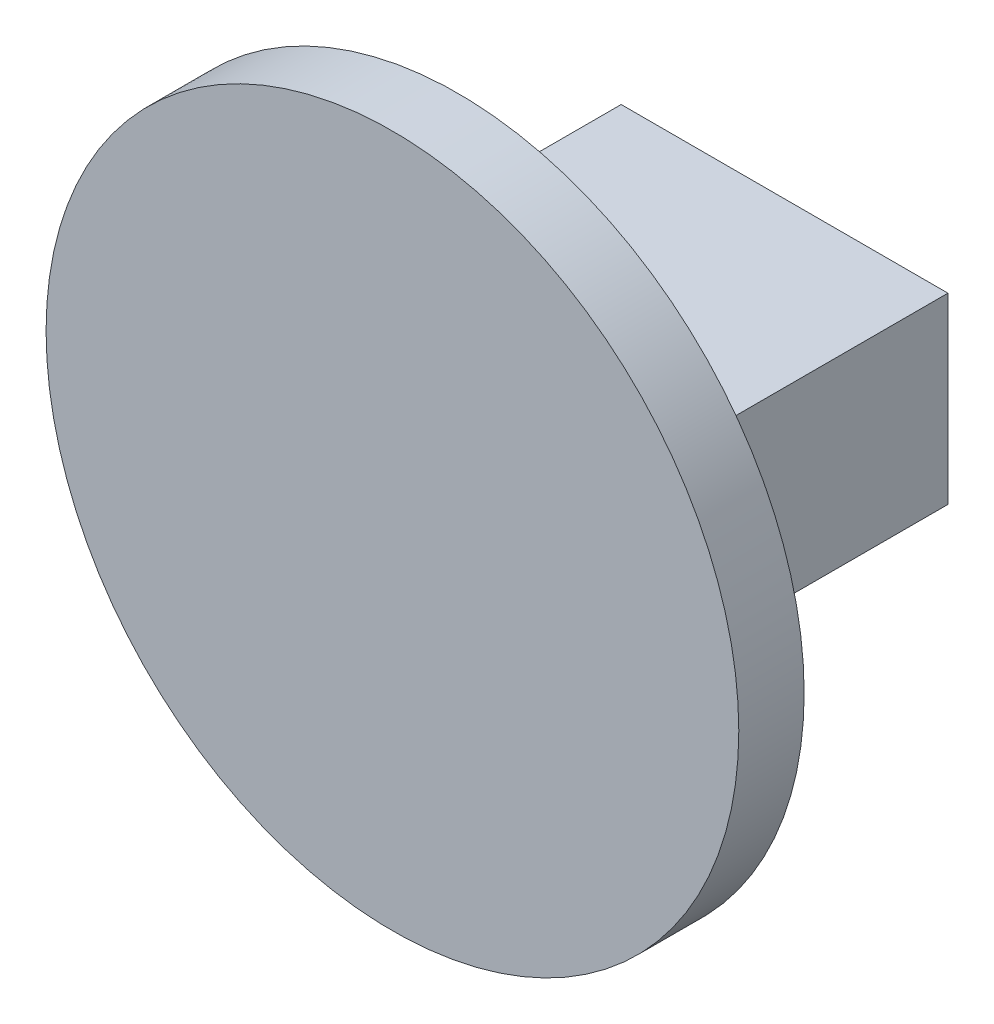
from build123d import *

# Parameters (mm, degrees)
SKETCH1_R           = 1346.2
BOSS_EXTRUDE3_DEPTH = 254
SKETCH2_W           = 1270
SKETCH2_H           = 711.2
BOSS_EXTRUDE6_DEPTH = 1270


with BuildPart() as part:
    # Sketch1 → Boss-Extrude3 (new body)
    with BuildSketch(Plane.XY):
        Circle(SKETCH1_R)
    extrude(amount=BOSS_EXTRUDE3_DEPTH)

    # Sketch2 → Boss-Extrude6 (add)
    with BuildSketch(Plane.XY):
        Rectangle(SKETCH2_W, SKETCH2_H)
    extrude(amount=-BOSS_EXTRUDE6_DEPTH)


solid = part.part
